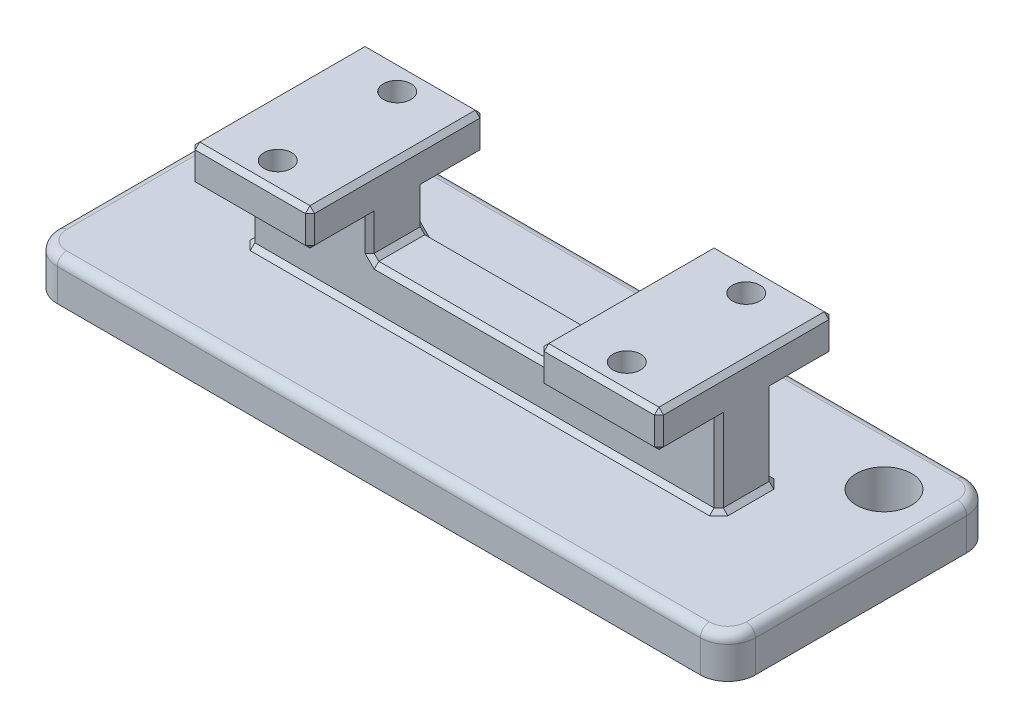
from build123d import *

# Parameters (mm, degrees)
SKETCH1_R                = 3
BOSS_EXTRUDE1_DEPTH      = 4.5
BOSS_EXTRUDE2_DEPTH      = 25.5
BOSS_EXTRUDE2_DEPTH_BACK = 25.5
CUT_EXTRUDE1_DEPTH       = 9.5
CUT_EXTRUDE1_DEPTH_BACK  = 9.5
SKETCH3_W                = 25
SKETCH3_H                = 16
CUT_EXTRUDE2_REACH       = 46.278
SKETCH4_R                = 1.5
FILLET1_R                = 1
CHAMFER1_SIZE            = 0.5


with BuildPart() as part:
    # Sketch1 → Boss-Extrude1 (new body)
    with BuildSketch(Plane(origin=(0, 0, 0), x_dir=(1, 0, 0), z_dir=(0, 1, 0))):
        with BuildLine():
            Line((-35, -14.5), (35, -14.5))
            ThreePointArc((35, -14.5), (37.121320344, -13.621320344), (38, -11.5))
            Line((38, -11.5), (38, 11.5))
            ThreePointArc((38, 11.5), (37.121320344, 13.621320344), (35, 14.5))
            Line((35, 14.5), (-35, 14.5))
            ThreePointArc((-35, 14.5), (-37.121320344, 13.621320344), (-38, 11.5))
            Line((-38, 11.5), (-38, -11.5))
            ThreePointArc((-38, -11.5), (-37.121320344, -13.621320344), (-35, -14.5))
        make_face()
        with Locations(Location((-32, 8.5, 0), (0, 0, 270))):
            Circle(SKETCH1_R, mode=Mode.SUBTRACT)
        with Locations(Location((32, 8.5, 0), (0, 0, 270))):
            Circle(SKETCH1_R, mode=Mode.SUBTRACT)
    extrude(amount=BOSS_EXTRUDE1_DEPTH)

    # Sketch2 → Boss-Extrude2 (add, two sides: drawn at the far end of the back side and taken through both)
    with BuildSketch(Plane(origin=(0, 0, 0), x_dir=(0, 0, -1), z_dir=(1, 0, 0)).offset(-BOSS_EXTRUDE2_DEPTH_BACK)):
        Polygon((-3, 4.5), (-3, 13.5), (-9.5, 13.5), (-9.5, 17.5), (9.5, 17.5), (9.5, 13.5), (3, 13.5), (3, 4.5), align=None)
    extrude(amount=BOSS_EXTRUDE2_DEPTH + BOSS_EXTRUDE2_DEPTH_BACK)

    # Sketch3 → Cut-Extrude1 (cut, two sides: drawn at the far end of the back side and taken through both)
    with BuildSketch(Plane.XY.offset(-CUT_EXTRUDE1_DEPTH_BACK)):
        with Locations((0, 17.5)):
            Rectangle(SKETCH3_W, SKETCH3_H)
    extrude(amount=CUT_EXTRUDE1_DEPTH + CUT_EXTRUDE1_DEPTH_BACK, mode=Mode.SUBTRACT)

    # Sketch4 → Cut-Extrude2 (cut, up to next)
    with BuildSketch(Plane(origin=(0, 17.5, 0), x_dir=(1, 0, 0), z_dir=(0, 1, 0)), mode=Mode.PRIVATE) as cut_extrude2_sk1:
        with Locations(Location((-19, 6.5, 0), (0, 0, 270))):
            Circle(SKETCH4_R)
    cut_extrude2_tool1 = extrude(cut_extrude2_sk1.sketch, amount=-CUT_EXTRUDE2_REACH, mode=Mode.PRIVATE) & part.part
    # Sketch4 → Cut-Extrude2 (cut, up to next)
    with BuildSketch(Plane(origin=(0, 17.5, 0), x_dir=(1, 0, 0), z_dir=(0, 1, 0)), mode=Mode.PRIVATE) as cut_extrude2_sk2:
        with Locations(Location((-19, -6.5, 0), (0, 0, 270))):
            Circle(SKETCH4_R)
    cut_extrude2_tool2 = extrude(cut_extrude2_sk2.sketch, amount=-CUT_EXTRUDE2_REACH, mode=Mode.PRIVATE) & part.part
    # Sketch4 → Cut-Extrude2 (cut, up to next)
    with BuildSketch(Plane(origin=(0, 17.5, 0), x_dir=(1, 0, 0), z_dir=(0, 1, 0)), mode=Mode.PRIVATE) as cut_extrude2_sk3:
        with Locations(Location((19, -6.5, 0), (0, 0, 270))):
            Circle(SKETCH4_R)
    cut_extrude2_tool3 = extrude(cut_extrude2_sk3.sketch, amount=-CUT_EXTRUDE2_REACH, mode=Mode.PRIVATE) & part.part
    # Sketch4 → Cut-Extrude2 (cut, up to next)
    with BuildSketch(Plane(origin=(0, 17.5, 0), x_dir=(1, 0, 0), z_dir=(0, 1, 0)), mode=Mode.PRIVATE) as cut_extrude2_sk4:
        with Locations(Location((19, 6.5, 0), (0, 0, 270))):
            Circle(SKETCH4_R)
    cut_extrude2_tool4 = extrude(cut_extrude2_sk4.sketch, amount=-CUT_EXTRUDE2_REACH, mode=Mode.PRIVATE) & part.part
    add(cut_extrude2_tool1.solids().sort_by_distance((-19, 17.5, -6.5))[0], mode=Mode.SUBTRACT)
    add(cut_extrude2_tool2.solids().sort_by_distance((-19, 17.5, 6.5))[0], mode=Mode.SUBTRACT)
    add(cut_extrude2_tool3.solids().sort_by_distance((19, 17.5, 6.5))[0], mode=Mode.SUBTRACT)
    add(cut_extrude2_tool4.solids().sort_by_distance((19, 17.5, -6.5))[0], mode=Mode.SUBTRACT)

    # Fillet1
    fillet1_edges = [part.edges().sort_by_distance(p)[0] for p in [
        (37.121320344, 4.5, 13.621320344),
        (38, 4.5, 0),
        (37.121320344, 4.5, -13.621320344),
        (0, 4.5, -14.5),
        (-37.121320344, 4.5, -13.621320344),
        (-38, 4.5, 0),
        (-37.121320344, 4.5, 13.621320344),
        (0, 4.5, 14.5),
    ]]
    fillet(fillet1_edges, radius=FILLET1_R)

    # Chamfer1
    chamfer1_edges = [part.edges().sort_by_distance(p)[0] for p in [
        (25.5, 9, 3),
        (25.5, 13.5, 6.25),
        (19, 13.5, 9.5),
        (25.5, 15.5, 9.5),
        (19, 17.5, 9.5),
        (25.5, 17.5, 0),
        (19, 17.5, -9.5),
        (25.5, 15.5, -9.5),
        (19, 13.5, -9.5),
        (25.5, 13.5, -6.25),
        (25.5, 9, -3),
        (0, 4.5, -3),
        (25.5, 4.5, 0),
        (0, 4.5, 3),
        (-25.5, 4.5, 0),
        (-25.5, 9, 3),
        (-25.5, 13.5, 6.25),
        (-25.5, 15.5, 9.5),
        (-25.5, 17.5, 0),
        (-25.5, 15.5, -9.5),
        (-25.5, 13.5, -6.25),
        (-25.5, 9, -3),
        (-12.5, 11.5, -3),
        (0, 9.5, -3),
        (12.5, 11.5, -3),
        (-19, 13.5, -9.5),
        (-19, 17.5, -9.5),
        (-19, 17.5, 9.5),
        (-19, 13.5, 9.5),
        (-12.5, 15.5, 9.5),
        (12.5, 15.5, 9.5),
        (12.5, 13.5, 6.25),
        (12.5, 11.5, 3),
        (12.5, 13.5, -6.25),
        (12.5, 15.5, -9.5),
        (12.5, 17.5, 0),
        (12.5, 9.5, 0),
        (0, 9.5, 3),
        (-12.5, 9.5, 0),
        (-12.5, 11.5, 3),
        (-12.5, 13.5, 6.25),
        (-12.5, 17.5, 0),
        (-12.5, 15.5, -9.5),
        (-12.5, 13.5, -6.25),
    ]]
    chamfer(chamfer1_edges, length=CHAMFER1_SIZE)


solid = part.part
